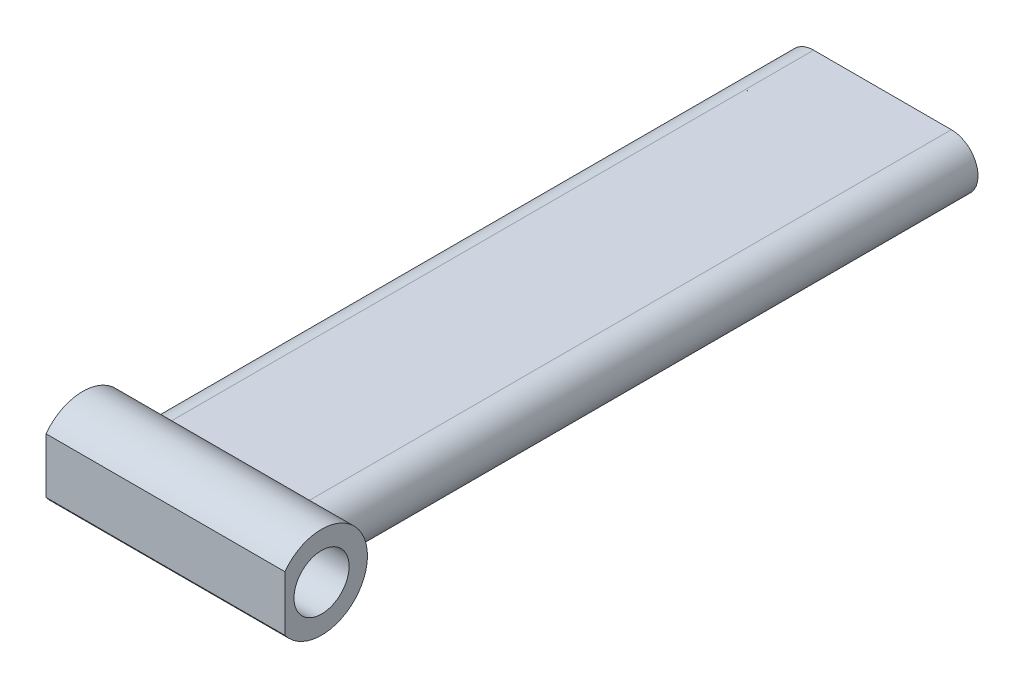
from build123d import *

# Parameters (mm, degrees)
BOSS_EXTRUDE1_DEPTH = 35
SKETCH9_R           = 5
BOSS_EXTRUDE3_DEPTH = 13
SKETCH10_W          = 39.744762059
SKETCH10_H          = 6.949903748
CUT_EXTRUDE1_DEPTH  = 13
SKETCH12_R          = 3
CUT_EXTRUDE3_DEPTH  = 51.56128384


with BuildPart() as part:
    # Sketch4 → Boss-Extrude1 (new, symmetric)
    with BuildSketch(Plane.XY):
        with BuildLine():
            Line((7.5, -2.9), (-7.5, -2.9))
            ThreePointArc((-7.5, -2.9), (-10.4, 0), (-7.5, 2.9))
            Line((-7.5, 2.9), (7.5, 2.9))
            ThreePointArc((7.5, 2.9), (10.4, 0), (7.5, -2.9))
        make_face()
        with BuildLine():
            Line((7.5, -1.9), (-7.5, -1.9))
            ThreePointArc((-7.5, -1.9), (-9.4, 0), (-7.5, 1.9))
            Line((-7.5, 1.9), (7.5, 1.9))
            ThreePointArc((7.5, 1.9), (9.4, 0), (7.5, -1.9))
        make_face(mode=Mode.SUBTRACT)
    extrude(amount=BOSS_EXTRUDE1_DEPTH, both=True)

    # Sketch9 → Boss-Extrude3 (add, symmetric)
    with BuildSketch(Plane(origin=(0, 0, 0), x_dir=(0, 0, -1), z_dir=(1, 0, 0))):
        with Locations((-39.073082371, 0.015275052)):
            Circle(SKETCH9_R)
    extrude(amount=BOSS_EXTRUDE3_DEPTH, both=True)

    # Sketch10 → Cut-Extrude1 (cut, symmetric)
    with BuildSketch(Plane(origin=(0, 0, 0), x_dir=(1, 0, 0), z_dir=(0, 1, 0))):
        with Locations((-2.189570447, -46.548034245)):
            Rectangle(SKETCH10_W, SKETCH10_H)
    extrude(amount=CUT_EXTRUDE1_DEPTH, both=True, mode=Mode.SUBTRACT)

    # Sketch12 → Cut-Extrude3 (cut, through all)
    with BuildSketch(Plane(origin=(13, 0, 0), x_dir=(0, 0, -1), z_dir=(1, 0, 0))):
        with Locations((-39.073082371, 0.015275052)):
            Circle(SKETCH12_R)
    extrude(amount=-CUT_EXTRUDE3_DEPTH, mode=Mode.SUBTRACT)


solid = part.part
